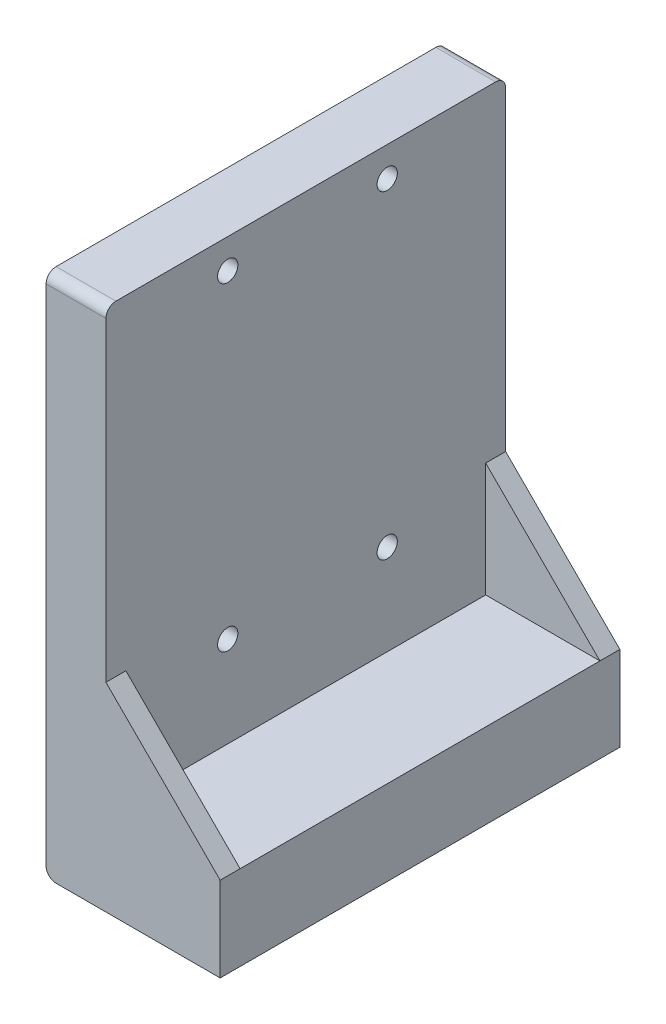
from build123d import *

# Parameters (mm, degrees)
BOSS_EXTRUDE1_DEPTH = 40.1
SKETCH3_R           = 1.35
CUT_EXTRUDE2_DEPTH  = 50.8
SKETCH4_R           = 1.016
CUT_EXTRUDE3_DEPTH  = 50.8
SKETCH6_W           = 62.086073973
SKETCH6_H           = 34.1
CUT_EXTRUDE4_DEPTH  = 6
BOSS_EXTRUDE5_DEPTH = 2
FILLET1_R           = 1
CUT_EXTRUDE5_DEPTH  = 101.73954578


with BuildPart() as part:
    # Sketch1 → Boss-Extrude1 (new body)
    with BuildSketch(Plane.XY):
        Polygon((0, 0), (0, 52.578), (6, 52.578), (6, 8.5), (76, 8.5), (76, 0), align=None)
    extrude(amount=BOSS_EXTRUDE1_DEPTH)

    # Sketch3 → Cut-Extrude2 (cut)
    with BuildSketch(Plane.XY.offset(40.1)):
        with Locations((27.996, 2.8)):
            Circle(SKETCH3_R)
        with Locations((49.996, 2.8)):
            Circle(SKETCH3_R)
        with Locations((71.996, 2.8)):
            Circle(SKETCH3_R)
    extrude(amount=-CUT_EXTRUDE2_DEPTH, mode=Mode.SUBTRACT)

    # Sketch4 → Cut-Extrude3 (cut)
    with BuildSketch(Plane.ZY):
        with Locations((27.88, 17.6)):
            Circle(SKETCH4_R)
        with Locations(Location((11.88, 17.6, 0), (0, 0, 270))):
            Circle(SKETCH4_R)
        with Locations((27.88, 49.6)):
            Circle(SKETCH4_R)
        with Locations(Location((11.88, 49.6, 0), (0, 0, 270))):
            Circle(SKETCH4_R)
    extrude(amount=-CUT_EXTRUDE3_DEPTH, mode=Mode.SUBTRACT)

    # Sketch6 → Cut-Extrude4 (cut)
    with BuildSketch(Plane.XZ):
        with Locations((50.043036987, 20.05)):
            Rectangle(SKETCH6_W, SKETCH6_H)
    extrude(amount=-CUT_EXTRUDE4_DEPTH, mode=Mode.SUBTRACT)

    # Sketch16 → Boss-Extrude5 (add)
    with BuildSketch(Plane.XY.offset(40.1)):
        Polygon((6, 8.5), (26, 8.5), (6, 33.5), align=None)
    boss_extrude5 = extrude(amount=-BOSS_EXTRUDE5_DEPTH)

    # Mirror2: Boss-Extrude5 across plane
    add(boss_extrude5.mirror(Plane(origin=(0, 0, 20.05), x_dir=(1, 0, 0), z_dir=(0, 0, -1))))

    # Fillet1
    fillet1_edges = [part.edges().sort_by_distance(p)[0] for p in [
        (0, 0, 20.05),
        (76, 0, 38.6),
        (3, 52.578, 40.1),
        (76, 0, 1.5),
        (3, 52.578, 0),
    ]]
    fillet(fillet1_edges, radius=FILLET1_R)

    # Sketch17 → Cut-Extrude5 (cut, through all)
    with BuildSketch(Plane.XY.offset(40.1)):
        with BuildLine():
            Line((17.4625, 0), (17.4625, 8.5))
            Line((17.4625, 8.5), (6, 19.9625))
            Line((6, 19.9625), (6, 33.5))
            Line((6, 33.5), (26, 8.5))
            Line((26, 8.5), (76, 8.5))
            Line((76, 8.5), (76, 1))
            ThreePointArc((76, 1), (75.707106781, 0.292893219), (75, 0))
            Line((75, 0), (17.4625, 0))
        make_face()
    extrude(amount=-CUT_EXTRUDE5_DEPTH, mode=Mode.SUBTRACT)


solid = part.part
